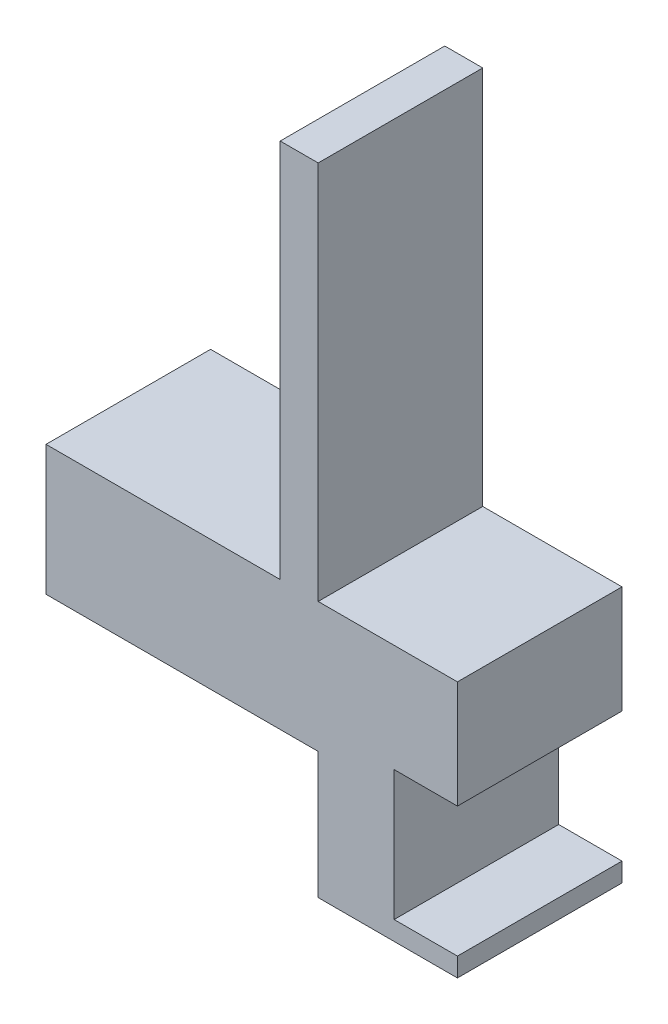
from build123d import *

# Parameters (mm, degrees)
BOSS_EXTRUDE1_DEPTH = 26
SKETCH2_W           = 6
SKETCH2_H           = 26
BOSS_EXTRUDE2_DEPTH = 60
SKETCH3_W           = 15.8
SKETCH3_H           = 10.5
CUT_EXTRUDE1_DEPTH  = 3


with BuildPart() as part:
    # Sketch1 → Boss-Extrude1 (new body)
    with BuildSketch(Plane.XY):
        Polygon((45, 20.52), (65, 20.52), (65, 3.52), (55, 3.52), (55, -17), (65, -17), (65, -20), (43, -20), (43, 0), (0, 0), (0, 20.52), align=None)
    extrude(amount=BOSS_EXTRUDE1_DEPTH)

    # Sketch2 → Boss-Extrude2 (add)
    with BuildSketch(Plane(origin=(0, 20.52, 0), x_dir=(1, 0, 0), z_dir=(0, 1, 0))):
        with Locations((40, -13)):
            Rectangle(SKETCH2_W, SKETCH2_H)
    extrude(amount=BOSS_EXTRUDE2_DEPTH)

    # Sketch3 → Cut-Extrude1 (cut)
    with BuildSketch(Plane.ZY.offset(-37)):
        with Locations((13, 70.52)):
            Rectangle(SKETCH3_W, SKETCH3_H)
    extrude(amount=-CUT_EXTRUDE1_DEPTH, mode=Mode.SUBTRACT)


solid = part.part
